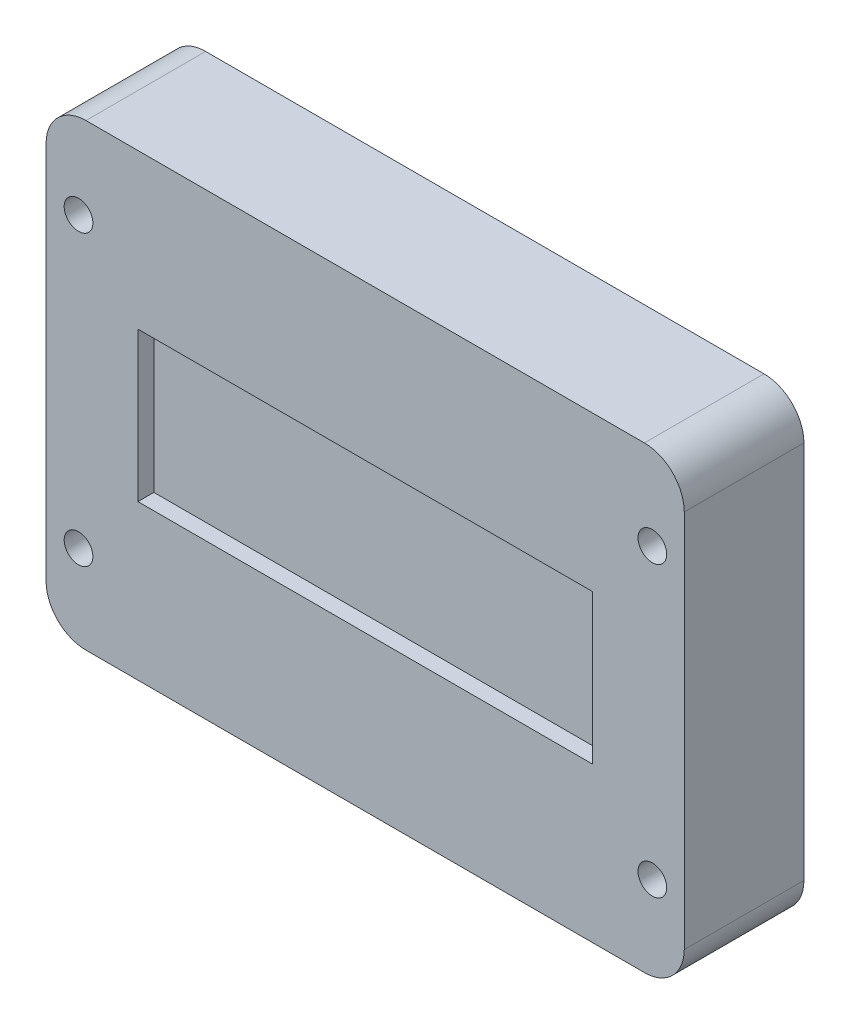
from build123d import *

# Parameters (mm, degrees)
SKETCH1_R           = 2.286
BOSS_EXTRUDE1_DEPTH = 19.05
SKETCH2_W           = 72.350889222
SKETCH2_H           = 23.78555394
CUT_EXTRUDE1_DEPTH  = 2.54


with BuildPart() as part:
    # Sketch1 → Boss-Extrude1 (new body)
    with BuildSketch(Plane.XY):
        with BuildLine():
            Line((-44.45, -36.5125), (44.45, -36.5125))
            ThreePointArc((44.45, -36.5125), (48.940128061, -34.652628061), (50.8, -30.1625))
            Line((50.8, -30.1625), (50.8, 30.1625))
            ThreePointArc((50.8, 30.1625), (48.940128061, 34.652628061), (44.45, 36.5125))
            Line((44.45, 36.5125), (-44.45, 36.5125))
            ThreePointArc((-44.45, 36.5125), (-48.940128061, 34.652628061), (-50.8, 30.1625))
            Line((-50.8, 30.1625), (-50.8, -30.1625))
            ThreePointArc((-50.8, -30.1625), (-48.940128061, -34.652628061), (-44.45, -36.5125))
        make_face()
        with Locations(Location((-45.632054244, 22.9235, 0), (0, 0, 180))):
            Circle(SKETCH1_R, mode=Mode.SUBTRACT)
        with Locations(Location((45.72, 22.9235, 0), (0, 0, 180))):
            Circle(SKETCH1_R, mode=Mode.SUBTRACT)
        with Locations(Location((45.72, -23.0505, 0), (0, 0, 180))):
            Circle(SKETCH1_R, mode=Mode.SUBTRACT)
        with Locations(Location((-45.632054244, -23.0505, 0), (0, 0, 180))):
            Circle(SKETCH1_R, mode=Mode.SUBTRACT)
    extrude(amount=BOSS_EXTRUDE1_DEPTH)

    # Sketch2 → Cut-Extrude1 (cut)
    with BuildSketch(Plane.XY.offset(19.05)):
        Rectangle(SKETCH2_W, SKETCH2_H)
    extrude(amount=-CUT_EXTRUDE1_DEPTH, mode=Mode.SUBTRACT)


solid = part.part
